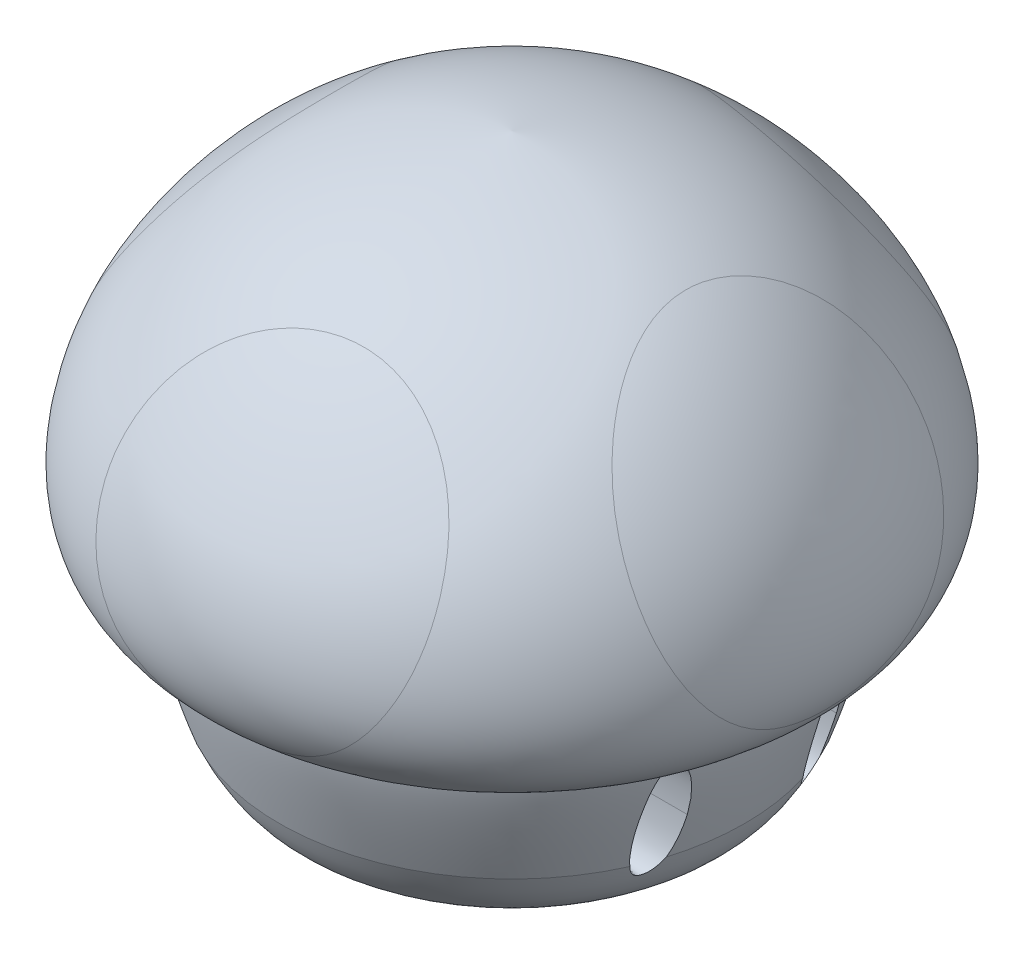
from build123d import *

# Parameters (mm, degrees)
ENL_V_MAT_EXTRU_1_DEPTH = 60


with BuildPart() as part:
    # Esquisse1 → Révolution7 (revolve)
    with BuildSketch(Plane.XY):
        with BuildLine():
            add(Edge.make_bspline(
                [(-48.115821059, -91.639635022), (-81.162687834, -98.263006724), (-103.223374652, -95.237383867), (-136.80854301, -97.427956975)],
                knots=[0, 0, 0, 0, 1, 1, 1, 1], degree=3))
            Line((-136.80854301, -97.427956975), (-136.80854301, 199.232434505))
            add(Edge.make_bspline(
                [(0, 0), (14.825022657, -0.445779429), (40.47879841, 22.27035649), (37.369228796, 75.509783122), (10.936069116, 125.837292255), (-44.022218749, 181.376202854), (-102.184349677, 195.60720694), (-136.80854301, 199.232434505)],
                knots=[0, 0, 0, 0, 0.131545771, 0.281325101, 0.463393923, 0.665747939, 1, 1, 1, 1], degree=3))
            add(Edge.make_bspline(
                [(0, 0), (0.385899472, -14.767811035), (-13.4484134, -56.569066259)],
                knots=[0, 0, 0, 1, 1, 1], degree=2))
            add(Edge.make_bspline(
                [(-13.4484134, -56.569066259), (-23.789517321, -79.040140508), (-29.931816795, -83.40536894), (-48.115821059, -91.639635022)],
                knots=[0, 0, 0, 0, 1, 1, 1, 1], degree=3))
        make_face()
    revolve(axis=Axis((-136.80854301, 199.232434505, 0), (0, -1, 0)))

    # Esquisse8 → Enlèv. mat.-Extru.1 (cut)
    with BuildSketch(Plane(origin=(10, 0, 0), x_dir=(0, 0, -1), z_dir=(1, 0, 0))):
        with BuildLine():
            add(Edge.make_bspline(
                [(53.020837129, -34.692060293), (52.857159542, -16.520236199), (48.292935061, -4.082593379), (36.377579821, -5.470892534), (33.224258834, -21.117710022), (33.020837129, -34.692060293)],
                knots=[0, 0, 0, 0, 0.406899514, 0.506899514, 1, 1, 1, 1], degree=3))
            add(Edge.make_bspline(
                [(53.020837129, -34.692060293), (52.857159542, -52.863884387), (48.292935061, -65.301527207), (36.377579821, -63.913228052), (33.224258834, -48.266410564), (33.020837129, -34.692060293)],
                knots=[0, 0, 0, 0, 0.406899514, 0.506899514, 1, 1, 1, 1], degree=3))
        make_face()
        with BuildLine():
            add(Edge.make_bspline(
                [(-53.020837129, -34.692060293), (-52.857159542, -52.863884387), (-48.292935061, -65.301527207), (-36.377579821, -63.913228052), (-33.224258834, -48.266410564), (-33.020837129, -34.692060293)],
                knots=[0, 0, 0, 0, 0.406899514, 0.506899514, 1, 1, 1, 1], degree=3))
            add(Edge.make_bspline(
                [(-53.020837129, -34.692060293), (-52.857159542, -16.520236199), (-48.292935061, -4.082593379), (-36.377579821, -5.470892534), (-33.224258834, -21.117710022), (-33.020837129, -34.692060293)],
                knots=[0, 0, 0, 0, 0.406899514, 0.506899514, 1, 1, 1, 1], degree=3))
        make_face()
    extrude(amount=-ENL_V_MAT_EXTRU_1_DEPTH, mode=Mode.SUBTRACT)


solid = part.part
